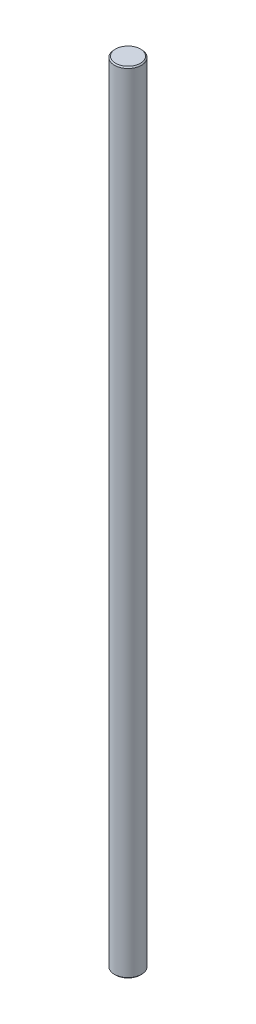
from build123d import *

# Parameters (mm, degrees)
SKETCH1_R           = 6
BOSS_EXTRUDE1_DEPTH = 175
CHAMFER1_SIZE       = 0.5


with BuildPart() as part:
    # Sketch1 → Boss-Extrude1 (new, symmetric)
    with BuildSketch(Plane(origin=(0, 0, 0), x_dir=(1, 0, 0), z_dir=(0, 1, 0))):
        with Locations(Location((0, 0, 0), (0, 0, 270))):
            Circle(SKETCH1_R)
    extrude(amount=BOSS_EXTRUDE1_DEPTH, both=True)

    # Chamfer1
    chamfer1_edges = [part.edges().sort_by_distance(p)[0] for p in [
        (0, -175, -6),
        (0, 175, -6),
    ]]
    chamfer(chamfer1_edges, length=CHAMFER1_SIZE)


solid = part.part
